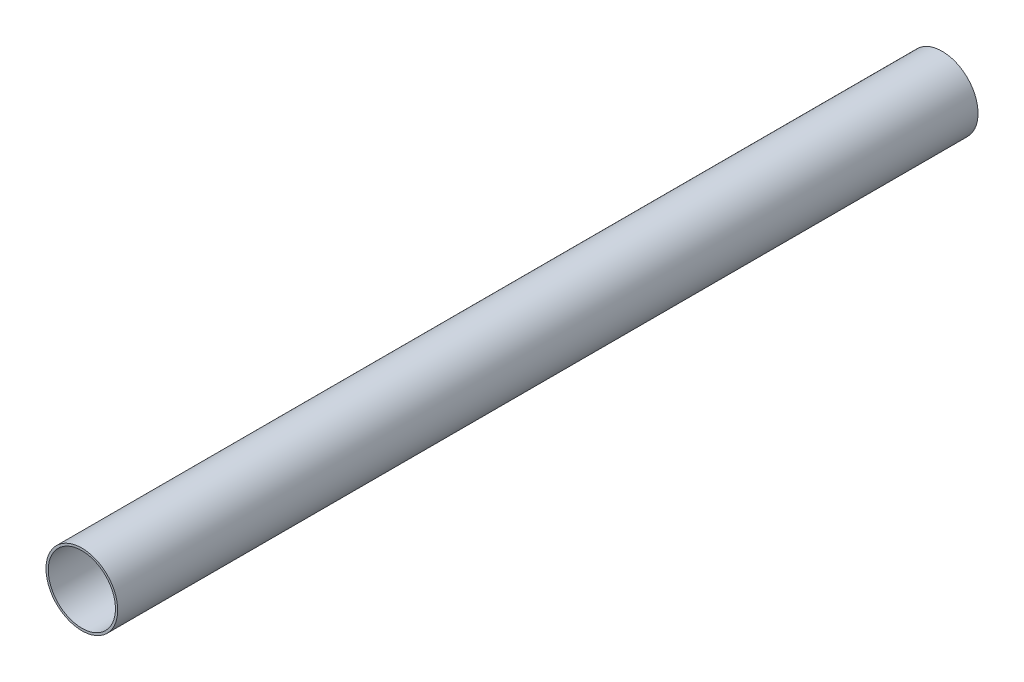
from build123d import *

# Parameters (mm, degrees)
SKETCH1_R           = 50.8
SKETCH1_R_2         = 47.625
BOSS_EXTRUDE1_DEPTH = 1219.2


with BuildPart() as part:
    # Sketch1 → Boss-Extrude1 (new body)
    with BuildSketch(Plane.XY):
        Circle(SKETCH1_R)
        Circle(SKETCH1_R_2, mode=Mode.SUBTRACT)
    extrude(amount=BOSS_EXTRUDE1_DEPTH)


solid = part.part
